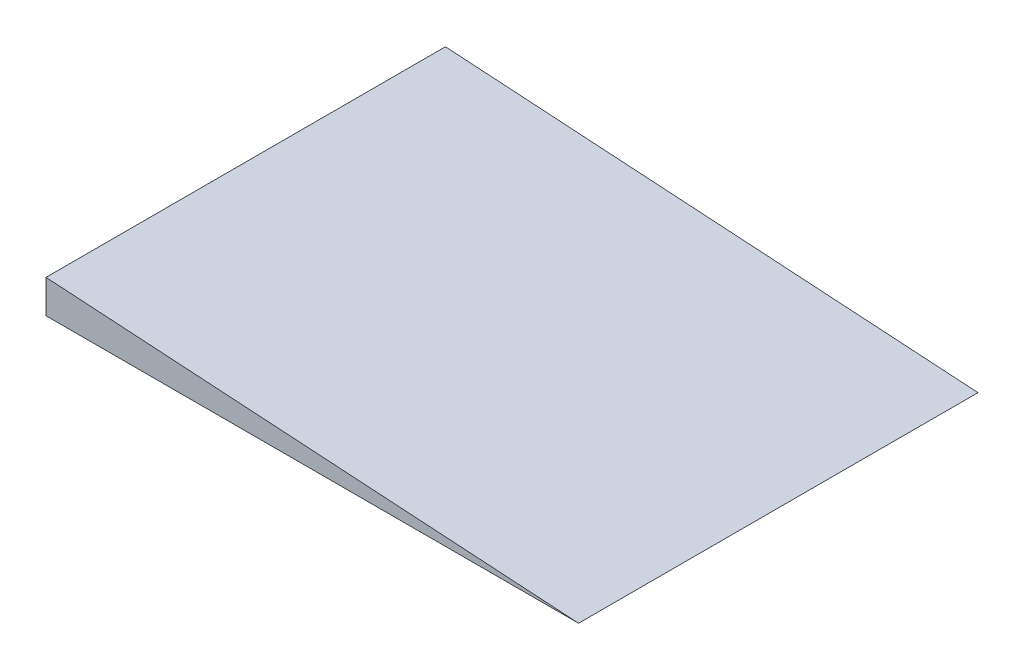
from build123d import *

# Parameters (mm, degrees)
BOSS_EXTRUDE1_DEPTH = 152.4


with BuildPart() as part:
    # Sketch1 → Boss-Extrude1 (new body)
    with BuildSketch(Plane.XY):
        Polygon((0, 0), (203.2, 0), (0, 12.7), align=None)
    extrude(amount=BOSS_EXTRUDE1_DEPTH)


solid = part.part
